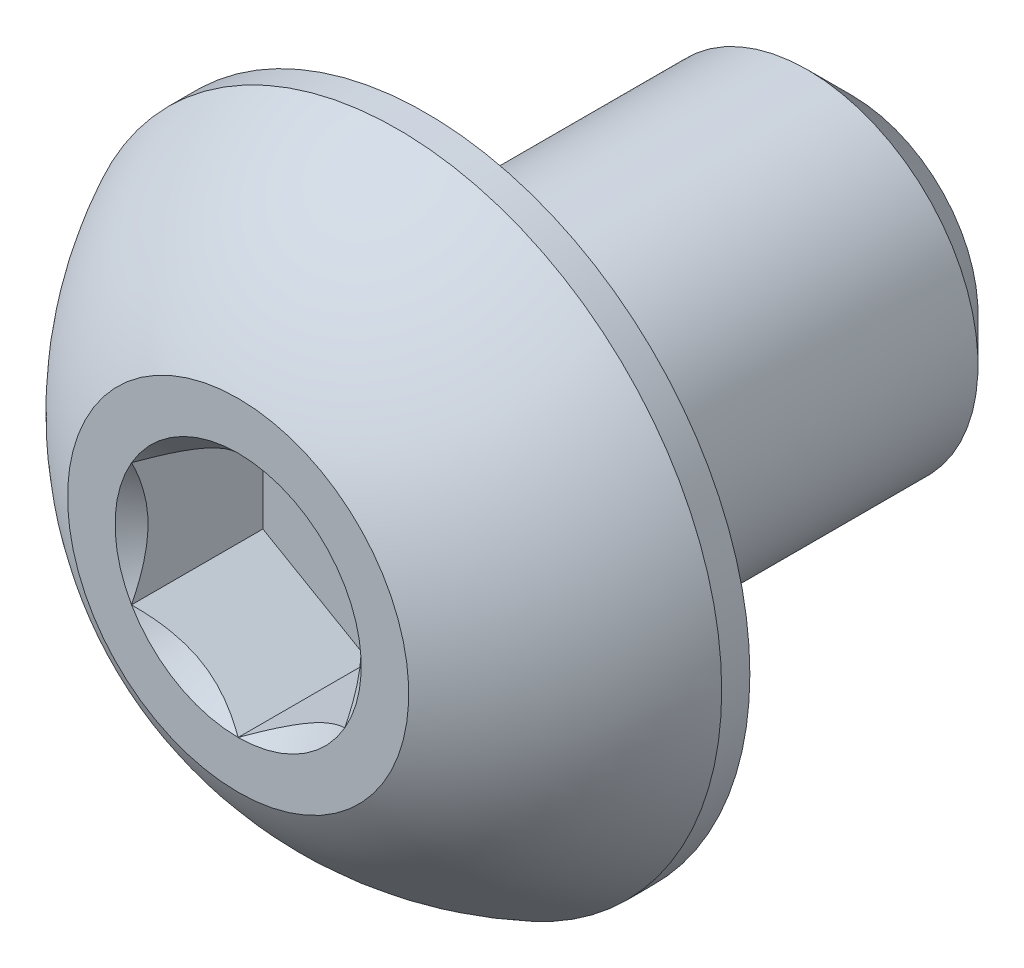
from build123d import *

# Parameters (mm, degrees)
SKETCH1_W          = 5
SKETCH1_H          = 2
CHAMFER1_SIZE      = 0.525
CUT_EXTRUDE2_DEPTH = 1.54


with BuildPart() as part:
    # Sketch1 → Revolve1 (revolve)
    with BuildSketch(Plane(origin=(0, 0, 0), x_dir=(0, 0, -1), z_dir=(1, 0, 0))):
        with Locations((4.7, 1)):
            Rectangle(SKETCH1_W, SKETCH1_H)
    revolve(axis=Axis((0, 0, -7.2), (0, 0, 1)))

    # Chamfer1
    chamfer1_edges = [part.edges().sort_by_distance(p)[0] for p in [
        (0, -2, -7.2),
    ]]
    chamfer(chamfer1_edges, length=CHAMFER1_SIZE)

    # Sketch7 → Revolve2 (revolve)
    with BuildSketch(Plane(origin=(0, 0, 0), x_dir=(0, 0, -1), z_dir=(1, 0, 0))):
        with BuildLine():
            Line((1.87, 3.8), (2.2, 3.8))
            Line((2.2, 3.8), (2.2, 0))
            Line((2.2, 0), (0, 0))
            Line((0, 0), (0, 2))
            ThreePointArc((0, 2), (0.793500147, 3.047002626), (1.87, 3.8))
        make_face()
    revolve(axis=Axis((0, 0, 0), (0, 0, -1)))

    # Sketch5 → Cut-Extrude2 (cut)
    with BuildSketch(Plane.XY):
        Polygon((1.25, -0.721687836), (1.25, 0.721687836), (0, 1.443375673), (-1.25, 0.721687836), (-1.25, -0.721687836), (0, -1.443375673), align=None)
    extrude(amount=-CUT_EXTRUDE2_DEPTH, mode=Mode.SUBTRACT)

    # Cut-Extrude3 cone 1 section (through the dimple's axis) → Cut-Extrude3 (revolve, cut)
    with BuildSketch(Plane(origin=(0, 0, 0), x_dir=(0, -1, 0), z_dir=(1, 0, 0))):
        Polygon((0, 0), (1.443375673, 0), (0, 1.443375673), align=None)
    revolve(axis=Axis((0, 0, 0), (0, 0, -1)), mode=Mode.SUBTRACT)


solid = part.part
